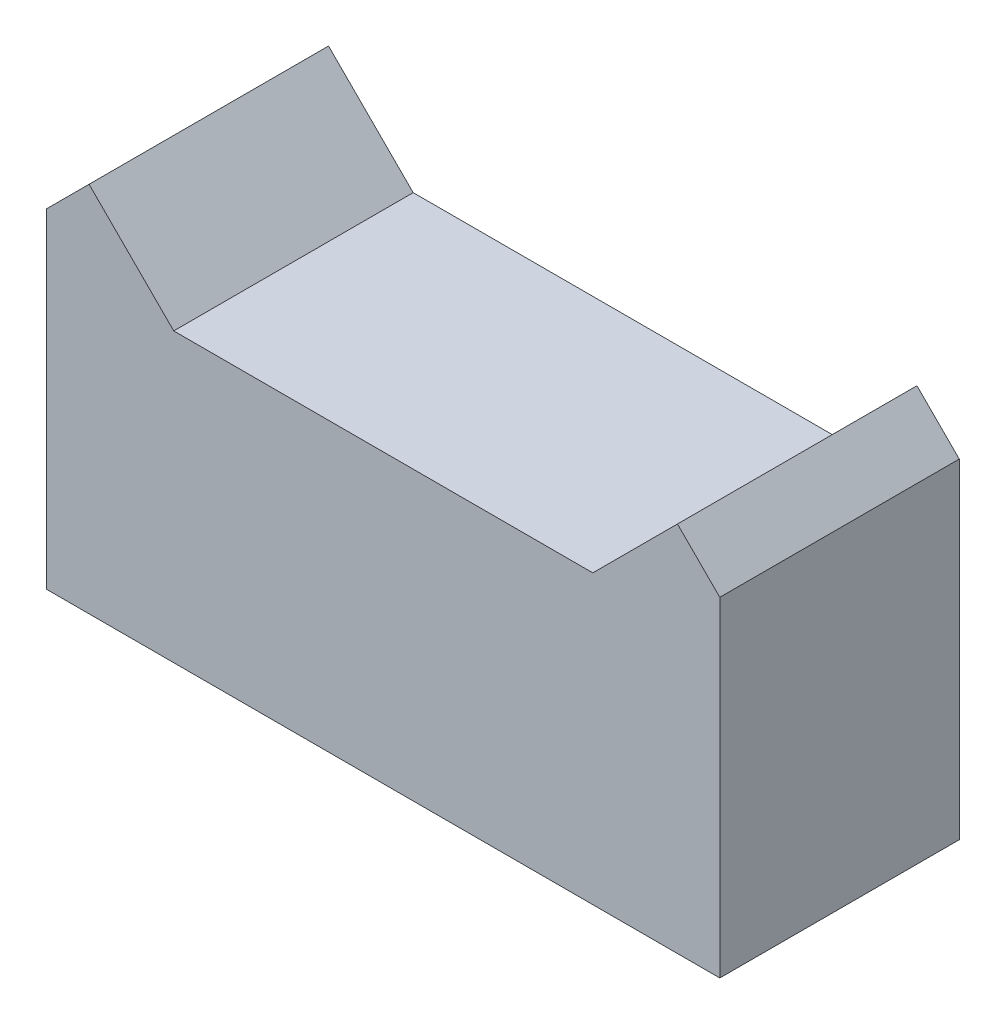
from build123d import *

# Parameters (mm, degrees)
BOSS_EXTRUDE1_DEPTH      = 10
BOSS_EXTRUDE1_DEPTH_BACK = 10
SKETCH3_W                = 19.984775587
SKETCH3_H                = 3
CUT_EXTRUDE1_DEPTH       = 10


with BuildPart() as part:
    # Sketch2 → Boss-Extrude1 (new, two sides: drawn at the far end of the back side and taken through both)
    with BuildSketch(Plane.XY.offset(-BOSS_EXTRUDE1_DEPTH_BACK)):
        Polygon((28.106601718, -45), (28.106601718, -17.464466094), (24.571067812, -13.928932188), (17.5, -21), (-17.5, -21), (-24.571067812, -13.928932188), (-28.106601718, -17.464466094), (-28.106601718, -45), align=None)
    extrude(amount=BOSS_EXTRUDE1_DEPTH + BOSS_EXTRUDE1_DEPTH_BACK)

    # Sketch3 → Cut-Extrude1 (cut)
    with BuildSketch(Plane(origin=(0, 0, -10), x_dir=(-1, 0, 0), z_dir=(0, 0, -1))):
        with Locations((0.007612206, -34.5)):
            Rectangle(SKETCH3_W, SKETCH3_H)
    extrude(amount=-CUT_EXTRUDE1_DEPTH, mode=Mode.SUBTRACT)


solid = part.part
